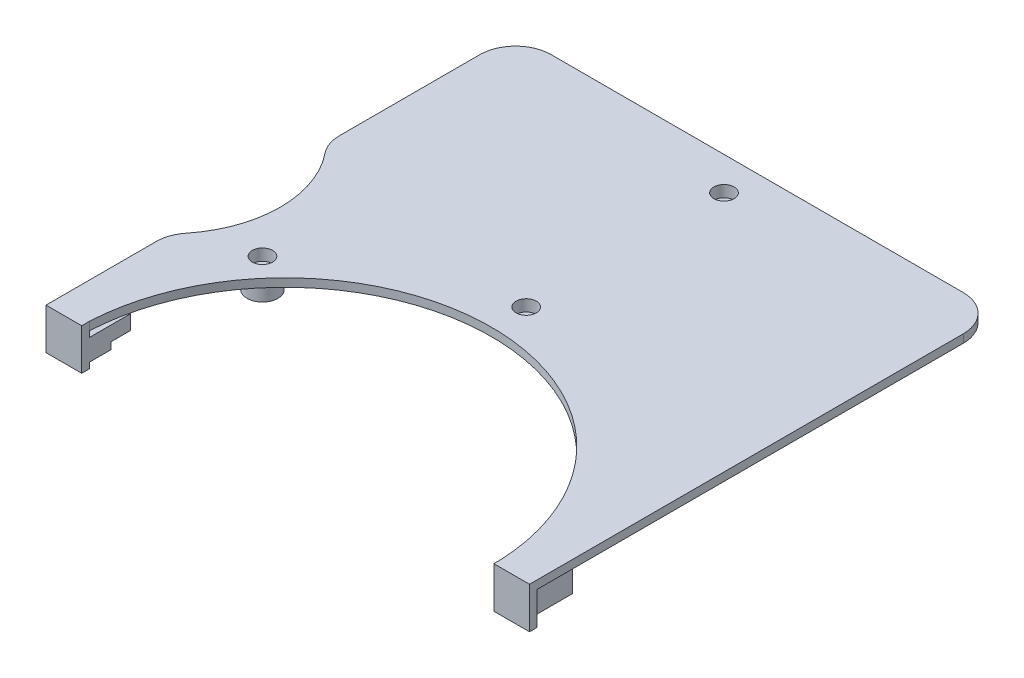
from build123d import *

# Parameters (mm, degrees)
BOSS_EXTRUDE1_DEPTH = 3
SKETCH2_W           = 13
SKETCH2_H           = 15
BOSS_EXTRUDE2_DEPTH = 2.8
SKETCH3_W           = 10.9
SKETCH3_H           = 7.8
SKETCH3_H_2         = 5.3
BOSS_EXTRUDE3_DEPTH = 15
SKETCH4_W           = 10.9
SKETCH4_H           = 2.5
BOSS_EXTRUDE4_DEPTH = 7.9
FILLET3_R           = 13
SKETCH5_R           = 5.6
SKETCH5_R_2         = 2.1
BOSS_EXTRUDE5_DEPTH = 5
CUT_EXTRUDE1_START  = -7.9
SKETCH6_R           = 2.1
CUT_EXTRUDE1_DEPTH  = 7.9
SKETCH7_R           = 3.7
CUT_EXTRUDE2_DEPTH  = 4.2
FILLET5_R           = 2
SKETCH8_R           = 5.6
SKETCH8_R_2         = 2.1
BOSS_EXTRUDE6_DEPTH = 2.5


with BuildPart() as part:
    # Sketch1 → Boss-Extrude1 (new body)
    with BuildSketch(Plane(origin=(0, 0, 0), x_dir=(1, 0, 0), z_dir=(0, 1, 0))):
        with BuildLine():
            Line((78.076457806, -38), (91.076457806, -38))
            Line((91.076457806, -38), (91.076457806, 130.104439919))
            Line((91.076457806, 130.104439919), (-84.923542194, 130.104439919))
            Line((-84.923542194, 130.104439919), (-84.923542194, 72.662298294))
            Line((-84.923542194, 72.662298294), (-84.923542194, 61.104439919))
            ThreePointArc((-84.923542194, 61.104439919), (-73.14747421, 32.674496882), (-84.923542194, 4.244553845))
            Line((-84.923542194, 4.244553845), (-84.923542194, 0))
            Line((-84.923542194, 0), (-84.923542194, -38))
            Line((-84.923542194, -38), (-71.923542194, -38))
            ThreePointArc((-71.923542194, -38), (3.076457806, 33.325120397), (78.076457806, -38))
        make_face()
    extrude(amount=BOSS_EXTRUDE1_DEPTH)

    # Sketch2 → Boss-Extrude2 (add)
    with BuildSketch(Plane.XY.offset(38)):
        with Locations((84.576457806, -4.5)):
            Rectangle(SKETCH2_W, SKETCH2_H)
        with Locations((-78.423542194, -4.5)):
            Rectangle(SKETCH2_W, SKETCH2_H)
    extrude(amount=BOSS_EXTRUDE2_DEPTH)

    # Sketch3 → Boss-Extrude3 (add)
    with BuildSketch(Plane(origin=(0, 0, 38), x_dir=(-1, 0, 0), z_dir=(0, 0, -1))):
        with Locations((-83.526457806, -6)):
            Rectangle(SKETCH3_W, SKETCH3_H)
        with Locations((77.373542194, -4.75)):
            Rectangle(SKETCH3_W, SKETCH3_H_2)
    extrude(amount=BOSS_EXTRUDE3_DEPTH)

    # Sketch4 → Boss-Extrude4 (add)
    with BuildSketch(Plane(origin=(0, 0, 38), x_dir=(-1, 0, 0), z_dir=(0, 0, -1))):
        with Locations((77.373542194, -8.65)):
            Rectangle(SKETCH4_W, SKETCH4_H)
    extrude(amount=BOSS_EXTRUDE4_DEPTH)

    # Fillet3
    fillet3_edges = [part.edges().sort_by_distance(p)[0] for p in [
        (-84.923542194, 1.5, -130.104439919),
        (91.076457806, 1.5, -130.104439919),
        (-84.923542194, 1.5, -4.244553845),
        (-84.923542194, 1.5, -61.104439919),
    ]]
    fillet(fillet3_edges, radius=FILLET3_R)

    # Sketch5 → Boss-Extrude5 (add)
    # profile 1 of 3: a face of its own
    with BuildSketch(Plane.XZ):
        with Locations(Location((3.076457806, -45.995120397, 0), (0, 0, 90))):
            Circle(SKETCH5_R)
        with Locations(Location((3.076457806, -45.995120397, 0), (0, 0, 270))):
            Circle(SKETCH5_R_2, mode=Mode.SUBTRACT)
    # profile 2 of 3: a face of its own
    with BuildSketch(Plane.XZ):
        with Locations(Location((-60.923542194, -13.995120397, 0), (0, 0, 90))):
            Circle(SKETCH5_R)
        with Locations(Location((-60.923542194, -13.995120397, 0), (0, 0, 270))):
            Circle(SKETCH5_R_2, mode=Mode.SUBTRACT)
    # profile 3 of 3: a face of its own
    with BuildSketch(Plane.XZ):
        with Locations(Location((3.076457806, -117.995120397, 0), (0, 0, 90))):
            Circle(SKETCH5_R)
        with Locations(Location((3.076457806, -117.995120397, 0), (0, 0, 270))):
            Circle(SKETCH5_R_2, mode=Mode.SUBTRACT)
    extrude(amount=BOSS_EXTRUDE5_DEPTH)

    # Sketch6 → Cut-Extrude1 (cut)
    with BuildSketch(Plane(origin=(0, 0, 0), x_dir=(-1, 0, 0), z_dir=(0, -1, 0)).offset(CUT_EXTRUDE1_START)):
        with Locations(Location((-3.076457806, 45.995120397, 0), (0, 0, 270))):
            Circle(SKETCH6_R)
        with Locations(Location((60.923542194, 13.995120397, 0), (0, 0, 270))):
            Circle(SKETCH6_R)
        with Locations(Location((-3.076457806, 117.995120397, 0), (0, 0, 270))):
            Circle(SKETCH6_R)
    extrude(amount=CUT_EXTRUDE1_DEPTH, mode=Mode.SUBTRACT)

    # Sketch7 → Cut-Extrude2 (cut)
    with BuildSketch(Plane(origin=(0, 3, 0), x_dir=(1, 0, 0), z_dir=(0, 1, 0))):
        with Locations(Location((3.076457806, 45.995120397, 0), (0, 0, 270))):
            Circle(SKETCH7_R)
        with Locations(Location((-60.923542194, 13.995120397, 0), (0, 0, 270))):
            Circle(SKETCH7_R)
        with Locations(Location((3.076457806, 117.995120397, 0), (0, 0, 270))):
            Circle(SKETCH7_R)
    extrude(amount=-CUT_EXTRUDE2_DEPTH, mode=Mode.SUBTRACT)

    # Fillet5
    fillet5_edges = [part.edges().sort_by_distance(p)[0] for p in [
        (3.076457806, 0, -51.595120397),
        (-60.923542194, 0, -19.595120397),
        (3.076457806, 0, -123.595120397),
    ]]
    fillet(fillet5_edges, radius=FILLET5_R)

    # Sketch8 → Boss-Extrude6 (add)
    # profile 1 of 2: a face of its own
    with BuildSketch(Plane.XZ.offset(5)):
        with Locations(Location((-60.923542194, -13.995120397, 0), (0, 0, 90))):
            Circle(SKETCH8_R)
        with Locations(Location((-60.923542194, -13.995120397, 0), (0, 0, 90))):
            Circle(SKETCH8_R_2, mode=Mode.SUBTRACT)
    # profile 2 of 2: a face of its own
    with BuildSketch(Plane.XZ.offset(5)):
        with Locations(Location((3.076457806, -117.995120397, 0), (0, 0, 90))):
            Circle(SKETCH8_R)
        with Locations(Location((3.076457806, -117.995120397, 0), (0, 0, 90))):
            Circle(SKETCH8_R_2, mode=Mode.SUBTRACT)
    extrude(amount=BOSS_EXTRUDE6_DEPTH)


solid = part.part
